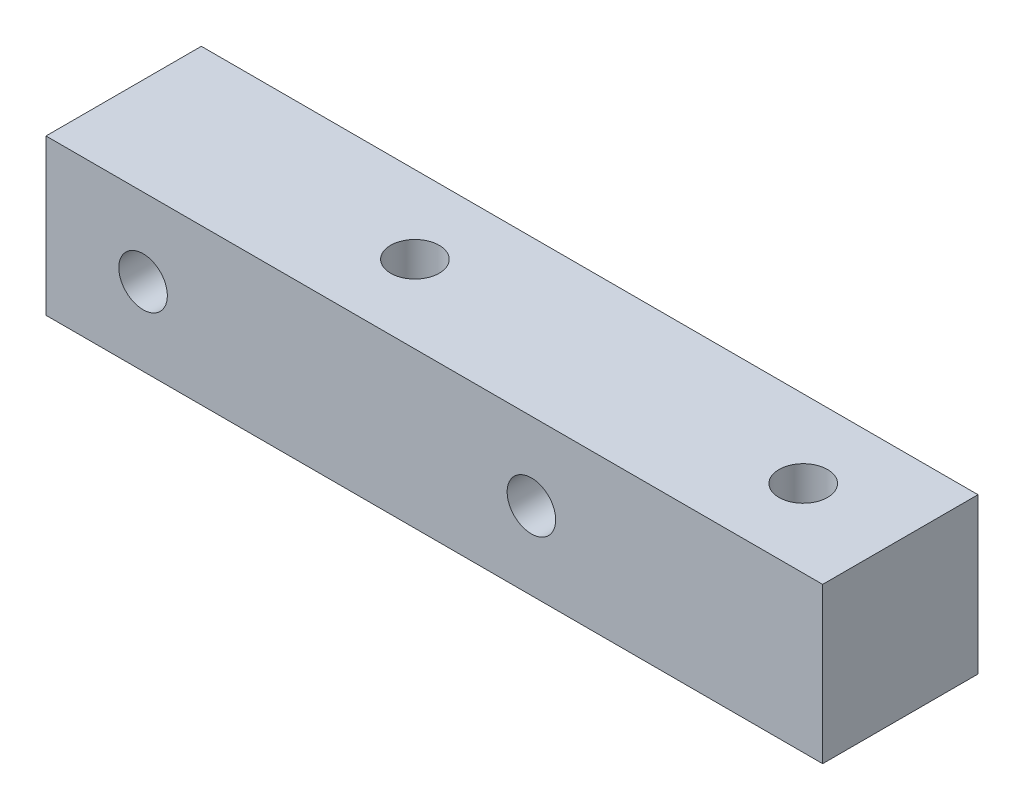
from build123d import *

# Parameters (mm, degrees)
SKETCH_1_W                   = 40
SKETCH_1_H                   = 8
EXTRUDE_1_DEPTH              = 8
HOLE_WIZARD_M3_1_D           = 2.5
HOLE_WIZARD_M3_1_ON_FACE_2_D = 2.5


with BuildPart() as part:
    # 草图1 → 凸台-拉伸1 (new body)
    with BuildSketch(Plane.XY):
        Rectangle(SKETCH_1_W, SKETCH_1_H)
    extrude(amount=EXTRUDE_1_DEPTH)

    # M3 螺纹孔的螺纹孔钻头1 (through all)
    with Locations(Plane(origin=(-5, 4, 4), x_dir=(1, 0, 0), z_dir=(0, 1, 0))):
        with Locations((0, 0), (20, 0)):
            Hole(HOLE_WIZARD_M3_1_D / 2)

    # M3 螺纹孔的螺纹孔钻头1 on face 2 (through all)
    with Locations(Plane(origin=(5, 0, 8), x_dir=(1, 0, 0), z_dir=(0, 0, 1))):
        with Locations((0, 0), (-20, 0)):
            Hole(HOLE_WIZARD_M3_1_ON_FACE_2_D / 2)


solid = part.part
